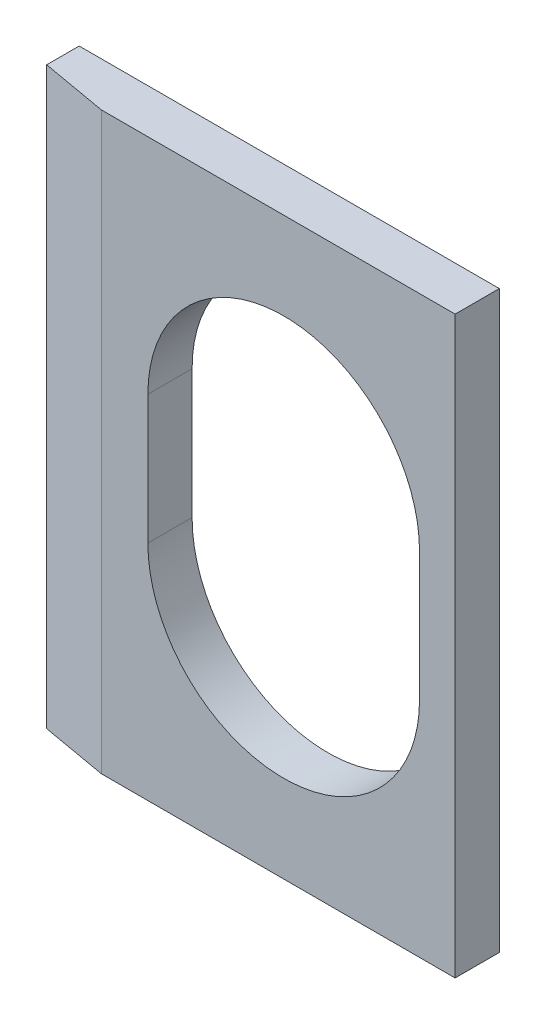
from build123d import *

# Parameters (mm, degrees)
SKETCH1_W           = 120.65
SKETCH1_H           = 165.1
BOSS_EXTRUDE1_DEPTH = 12.7
CUT_EXTRUDE1_REACH  = 105.029
CUT_EXTRUDE2_REACH  = 178.234


with BuildPart() as part:
    # Sketch1 → Boss-Extrude1 (new body)
    with BuildSketch(Plane.XY):
        Rectangle(SKETCH1_W, SKETCH1_H)
    extrude(amount=BOSS_EXTRUDE1_DEPTH)

    # Sketch2 → Cut-Extrude1 (cut, up to next)
    with BuildSketch(Plane.XY.offset(12.7), mode=Mode.PRIVATE) as cut_extrude1_sk1:
        with BuildLine():
            Line((50.1015, 18.5039), (50.1015, -18.5039))
            ThreePointArc((50.1015, -18.5039), (11.0998, -57.5056), (-27.9019, -18.5039))
            Line((-27.9019, -18.5039), (-27.9019, 18.5039))
            ThreePointArc((-27.9019, 18.5039), (11.0998, 57.5056), (50.1015, 18.5039))
        make_face()
    cut_extrude1_tool1 = extrude(cut_extrude1_sk1.sketch, amount=-CUT_EXTRUDE1_REACH, mode=Mode.PRIVATE) & part.part
    add(cut_extrude1_tool1.solids().sort_by_distance((11.0998, 0, 12.7))[0], mode=Mode.SUBTRACT)

    # Sketch3 → Cut-Extrude2 (cut, up to next)
    with BuildSketch(Plane(origin=(0, 82.55, 0), x_dir=(1, 0, 0), z_dir=(0, 1, 0)), mode=Mode.PRIVATE) as cut_extrude2_sk1:
        Polygon((-41.276197421, -12.7), (-60.325, -9.341182155), (-60.325, -12.7), align=None)
    cut_extrude2_tool1 = extrude(cut_extrude2_sk1.sketch, amount=-CUT_EXTRUDE2_REACH, mode=Mode.PRIVATE) & part.part
    add(cut_extrude2_tool1.solids().sort_by_distance((-53.975399, 82.55, 11.580394))[0], mode=Mode.SUBTRACT)


solid = part.part
